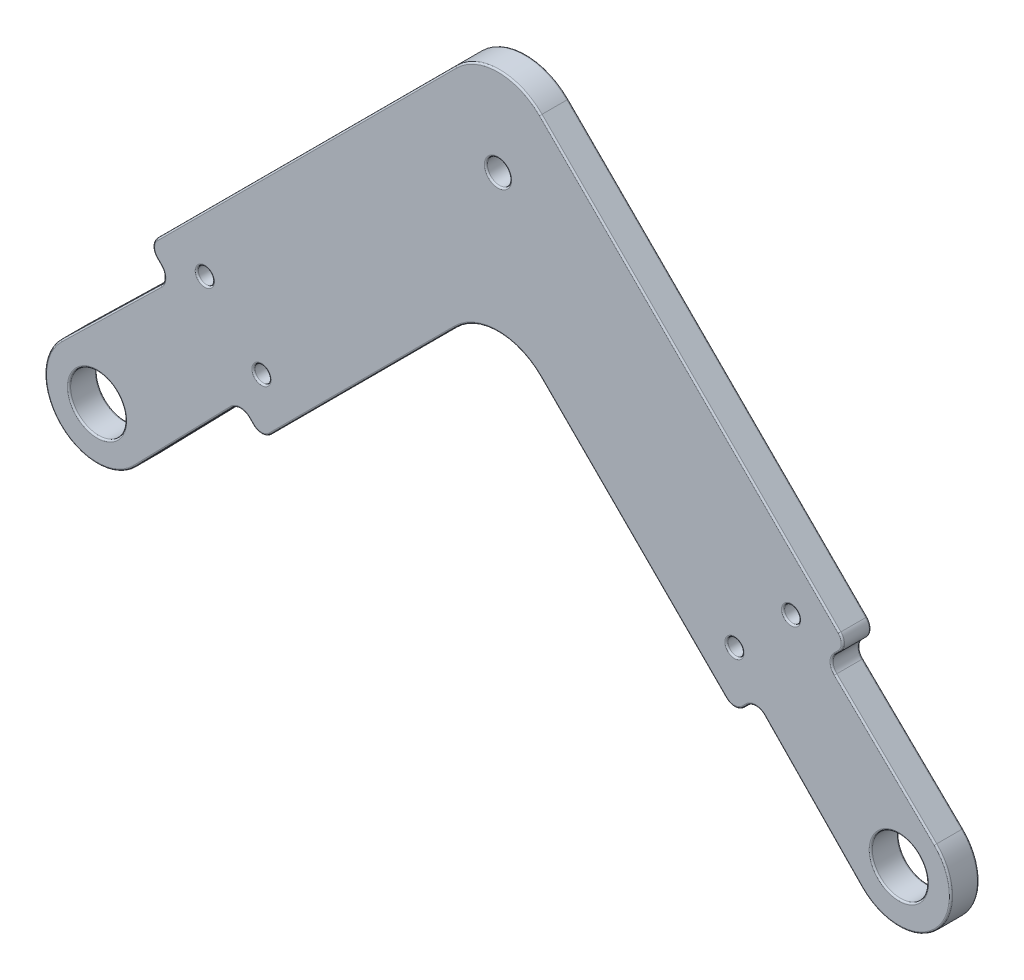
from build123d import *

# Parameters (mm, degrees)
SKETCH5_R           = 3.5
SKETCH5_R_2         = 1
SKETCH5_R_3         = 1.5
BOSS_EXTRUDE1_DEPTH = 3.5
FILLET1_R           = 7.5
FILLET2_R           = 1.5
FILLET3_R           = 0.2


with BuildPart() as part:
    # Sketch5 → Boss-Extrude1 (new body)
    with BuildSketch(Plane.XY):
        with BuildLine():
            Line((-82.149090724, 9.019148409), (-95.342398812, -4.533955357))
            ThreePointArc((-95.342398812, -4.533955357), (-104.596194078, -4.596194078), (-104.533955357, 4.657601188))
            Line((-104.533955357, 4.657601188), (-90.980851591, 17.850909276))
            Line((-90.980851591, 17.850909276), (-93.636038969, 20.506096654))
            Line((-93.636038969, 20.506096654), (-50, 64.142135624))
            Line((-50, 64.142135624), (-6.363961031, 20.506096654))
            Line((-6.363961031, 20.506096654), (-9.019148409, 17.850909276))
            Line((-9.019148409, 17.850909276), (4.533955357, 4.657601188))
            ThreePointArc((4.533955357, 4.657601188), (4.596194078, -4.596194078), (-4.657601188, -4.533955357))
            Line((-4.657601188, -4.533955357), (-17.850909276, 9.019148409))
            Line((-17.850909276, 9.019148409), (-20.506096654, 6.363961031))
            Line((-20.506096654, 6.363961031), (-50, 35.857864376))
            Line((-50, 35.857864376), (-79.493903346, 6.363961031))
            Line((-79.493903346, 6.363961031), (-82.149090724, 9.019148409))
        make_face()
        Circle(SKETCH5_R, mode=Mode.SUBTRACT)
        with Locations((-100, 0)):
            Circle(SKETCH5_R, mode=Mode.SUBTRACT)
        with Locations((-86.564971157, 20.506096654)):
            Circle(SKETCH5_R_2, mode=Mode.SUBTRACT)
        with Locations((-50, 50)):
            Circle(SKETCH5_R_3, mode=Mode.SUBTRACT)
        with Locations((-13.435028843, 20.506096654)):
            Circle(SKETCH5_R_2, mode=Mode.SUBTRACT)
        with Locations((-20.506096654, 13.435028843)):
            Circle(SKETCH5_R_2, mode=Mode.SUBTRACT)
        with Locations((-79.493903346, 13.435028843)):
            Circle(SKETCH5_R_2, mode=Mode.SUBTRACT)
    extrude(amount=BOSS_EXTRUDE1_DEPTH)

    # Fillet1
    fillet1_edges = [part.edges().sort_by_distance(p)[0] for p in [
        (-50, 64.142135624, 1.75),
        (-50, 35.857864376, 1.75),
    ]]
    fillet(fillet1_edges, radius=FILLET1_R)

    # Fillet2
    fillet2_edges = [part.edges().sort_by_distance(p)[0] for p in [
        (-82.149090724, 9.019148409, 1.75),
        (-90.980851591, 17.850909276, 1.75),
        (-93.636038969, 20.506096654, 1.75),
        (-6.363961031, 20.506096654, 1.75),
        (-9.019148409, 17.850909276, 1.75),
        (-17.850909276, 9.019148409, 1.75),
        (-20.506096654, 6.363961031, 1.75),
        (-79.493903346, 6.363961031, 1.75),
    ]]
    fillet(fillet2_edges, radius=FILLET2_R)

    # Fillet3
    fillet3_edges = [part.edges().sort_by_distance(p)[0] for p in [
        (-91.616569941, 17.855184959, 0),
        (-91.616569941, 17.855184959, 3.5),
        (-82.144815041, 8.383430059, 0),
        (-82.144815041, 8.383430059, 3.5),
        (-8.383430059, 17.855184959, 0),
        (-8.383430059, 17.855184959, 3.5),
        (-17.855184959, 8.383430059, 0),
        (-17.855184959, 8.383430059, 3.5),
        (-89.275978249, 1.697903009, 0),
        (-104.596194078, -4.596194078, 0),
        (-1.697903009, 10.724021751, 0),
        (4.596194078, -4.596194078, 0),
        (4.596194078, -4.596194078, 3.5),
        (-1.697903009, 10.724021751, 3.5),
        (-3.5, 0, 0),
        (-3.5, 0, 3.5),
        (-103.5, 0, 0),
        (-103.5, 0, 3.5),
        (-87.564971157, 20.506096654, 0),
        (-87.564971157, 20.506096654, 3.5),
        (-51.5, 50, 0),
        (-51.5, 50, 3.5),
        (-14.435028843, 20.506096654, 0),
        (-14.435028843, 20.506096654, 3.5),
        (-104.596194078, -4.596194078, 3.5),
        (-21.506096654, 13.435028843, 0),
        (-21.506096654, 13.435028843, 3.5),
        (-89.275978249, 1.697903009, 3.5),
        (-80.493903346, 13.435028843, 0),
        (-80.493903346, 13.435028843, 3.5),
        (-33.131727984, 18.98959236, 0),
        (-33.131727984, 18.98959236, 3.5),
        (-73.939339828, 40.202795796, 0),
        (-73.939339828, 40.202795796, 3.5),
        (-50, 61.035533906, 0),
        (-50, 61.035533906, 3.5),
        (-50, 32.751262658, 0),
        (-50, 32.751262658, 3.5),
        (-98.302096991, 10.724021751, 0),
        (-98.302096991, 10.724021751, 3.5),
        (-92.315627321, 19.185685006, 0),
        (-92.315627321, 19.185685006, 3.5),
        (-26.060660172, 40.202795796, 0),
        (-7.684372679, 19.185685006, 0),
        (-10.724021751, 1.697903009, 0),
        (-19.185685006, 7.684372679, 0),
        (-66.868272016, 18.98959236, 0),
        (-80.814314994, 7.684372679, 0),
        (-20.506096654, 6.985281374, 0),
        (-6.985281374, 20.506096654, 0),
        (-79.493903346, 6.985281374, 0),
        (-93.014718626, 20.506096654, 0),
        (-26.060660172, 40.202795796, 3.5),
        (-80.814314994, 7.684372679, 3.5),
        (-66.868272016, 18.98959236, 3.5),
        (-19.185685006, 7.684372679, 3.5),
        (-10.724021751, 1.697903009, 3.5),
        (-7.684372679, 19.185685006, 3.5),
        (-20.506096654, 6.985281374, 3.5),
        (-6.985281374, 20.506096654, 3.5),
        (-79.493903346, 6.985281374, 3.5),
        (-93.014718626, 20.506096654, 3.5),
    ]]
    fillet(fillet3_edges, radius=FILLET3_R)


solid = part.part
